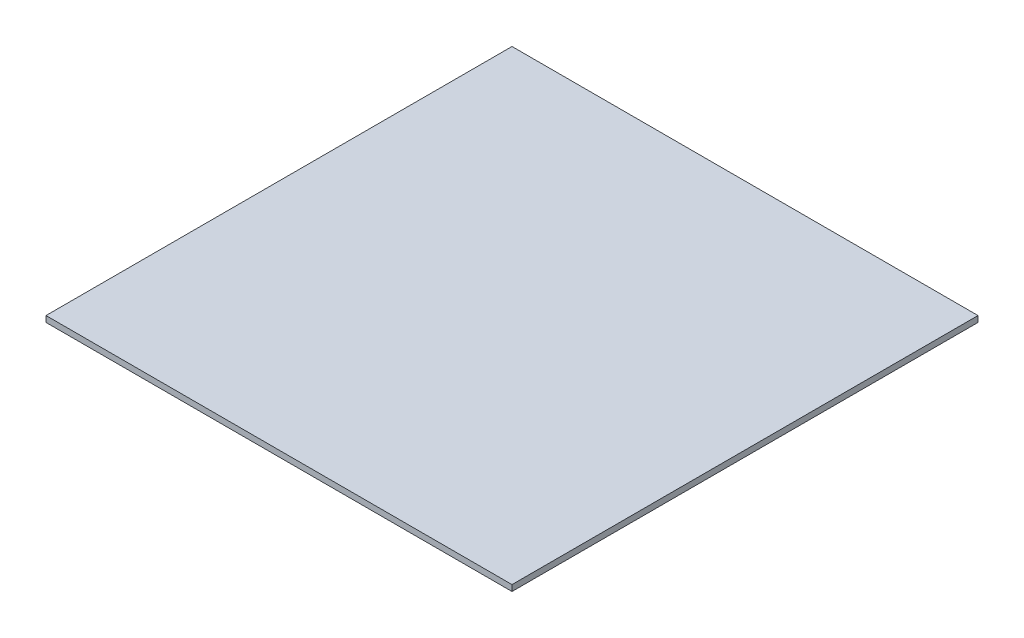
from build123d import *

# Parameters (mm, degrees)
SKETCH_1_W      = 310
SKETCH_1_H      = 310
EXTRUDE_1_DEPTH = 4
SKETCH_2_R      = 2
EXTRUDE_2_DEPTH = 25


with BuildPart() as part:
    # Эскиз1 → Бобышка-Вытянуть1 (new body)
    with BuildSketch(Plane(origin=(0, 0, 0), x_dir=(1, 0, 0), z_dir=(0, 1, 0))):
        with Locations((155, 155)):
            Rectangle(SKETCH_1_W, SKETCH_1_H)
    extrude(amount=EXTRUDE_1_DEPTH)

    # Эскиз2 → Бобышка-Вытянуть2 (add)
    with BuildSketch(Plane.XZ):
        with Locations(Location((272.5, -37.5, 0), (0, 0, 270))):
            Circle(SKETCH_2_R)
        with Locations(Location((272.5, -272.5, 0), (0, 0, 270))):
            Circle(SKETCH_2_R)
        with Locations(Location((37.5, -37.5, 0), (0, 0, 270))):
            Circle(SKETCH_2_R)
        with Locations(Location((37.5, -272.5, 0), (0, 0, 270))):
            Circle(SKETCH_2_R)
    extrude(amount=EXTRUDE_2_DEPTH)


solid = part.part
